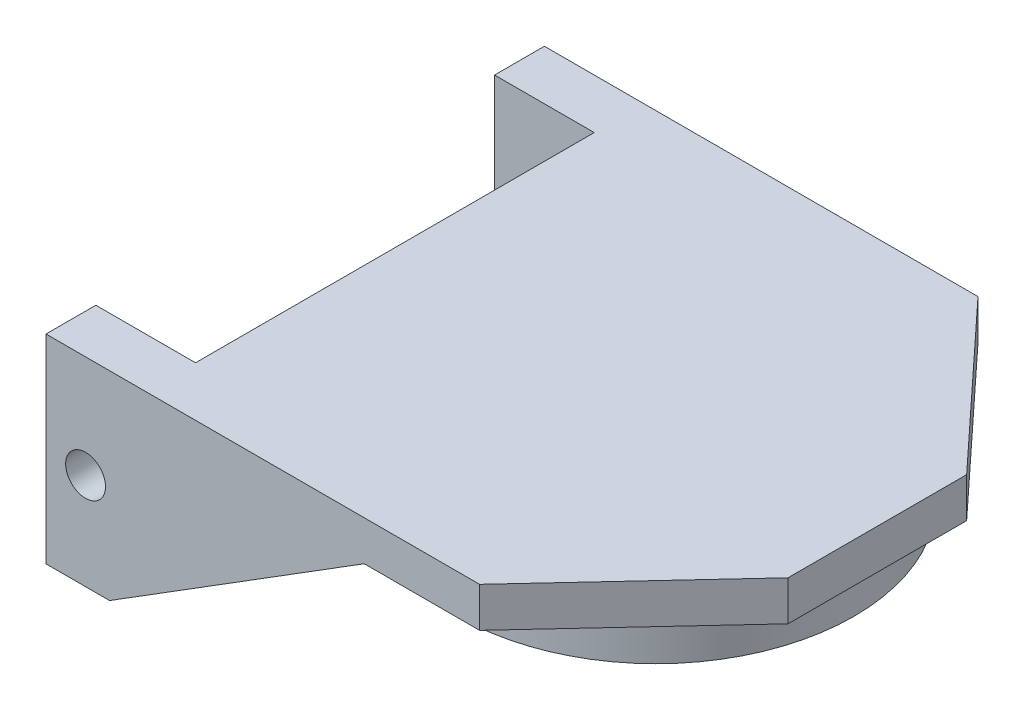
from build123d import *

# Parameters (mm, degrees)
BOSS_EXTRUDE1_DEPTH = 2
BOSS_EXTRUDE2_DEPTH = 2
SKETCH3_R           = 1
BOSS_EXTRUDE3_DEPTH = 2.5
SKETCH5_R           = 1
BOSS_EXTRUDE5_DEPTH = 2.5
SKETCH6_R           = 1
CUT_EXTRUDE1_DEPTH  = 2.5
BOSS_EXTRUDE6_START = -2.5
SKETCH8_R           = 1
BOSS_EXTRUDE6_DEPTH = 2.5
CUT_EXTRUDE2_DEPTH  = 2.5
SKETCH10_R          = 9.941576331
SKETCH10_R_2        = 9.5
BOSS_EXTRUDE9_DEPTH = 2.5


with BuildPart() as part:
    # Sketch1 → Boss-Extrude1 (new body)
    with BuildSketch(Plane(origin=(0, 0, 0), x_dir=(1, 0, 0), z_dir=(0, 1, 0))):
        Polygon((0, 2.5), (0, 0), (26, 0), (26, 25), (0, 25), (0, 22.5), (5, 22.5), (5, 2.5), align=None)
    extrude(amount=BOSS_EXTRUDE1_DEPTH)

    # Sketch2 → Boss-Extrude2 (add)
    with BuildSketch(Plane(origin=(0, 2, 0), x_dir=(1, 0, 0), z_dir=(0, 1, 0))):
        Polygon((26, 25), (40.579221248, 15.4966373), (40.579221248, 9.198619924), (26, 0), align=None)
    extrude(amount=-BOSS_EXTRUDE2_DEPTH)

    # Sketch3 → Boss-Extrude3 (add)
    with BuildSketch(Plane.XY):
        Polygon((15.962952465, 0), (0, 0), (0, -7.986136178), (3.187790207, -7.986136178), align=None)
        with Locations((1.984518411, -4.657937593)):
            Circle(SKETCH3_R, mode=Mode.SUBTRACT)
    extrude(amount=-BOSS_EXTRUDE3_DEPTH)

    # Sketch5 → Boss-Extrude5 (add)
    with BuildSketch(Plane.XY):
        with Locations((1.984518411, -4.657937593)):
            Circle(SKETCH5_R)
    extrude(amount=-BOSS_EXTRUDE5_DEPTH)

    # Sketch6 → Cut-Extrude1 (cut)
    with BuildSketch(Plane.XY):
        with Locations((1.984518411, -3.146677254)):
            Circle(SKETCH6_R)
    extrude(amount=-CUT_EXTRUDE1_DEPTH, mode=Mode.SUBTRACT)

    # Sketch8 → Boss-Extrude6 (add)
    with BuildSketch(Plane(origin=(0, 0, -25), x_dir=(-1, 0, 0), z_dir=(0, 0, -1)).offset(BOSS_EXTRUDE6_START)):
        Polygon((0, 0), (0, -7.986136178), (-3.187790207, -7.986136178), (-15.962952465, 0), align=None)
        with Locations(Location((-1.984518411, -3.146677254, 0), (0, 0, 180))):
            Circle(SKETCH8_R, mode=Mode.SUBTRACT)
    extrude(amount=BOSS_EXTRUDE6_DEPTH)

    # Sketch9 → Cut-Extrude2 (cut)
    with BuildSketch(Plane(origin=(0, 2, 0), x_dir=(1, 0, 0), z_dir=(0, 1, 0))):
        Polygon((21.748897696, 25), (29.198942219, 16.980267325), (29.198942219, 8.019732675), (21.748897696, 0), (26, 0), (40.579221248, 9.198619924), (40.579221248, 15.4966373), (26, 25), align=None)
    extrude(amount=-CUT_EXTRUDE2_DEPTH, mode=Mode.SUBTRACT)

    # Sketch10 → Boss-Extrude9 (add)
    with BuildSketch(Plane.XZ):
        with Locations(Location((18.089845789, -12.5, 0), (0, 0, 90))):
            Circle(SKETCH10_R)
        with Locations(Location((18.089845789, -12.5, 0), (0, 0, 270))):
            Circle(SKETCH10_R_2, mode=Mode.SUBTRACT)
    extrude(amount=BOSS_EXTRUDE9_DEPTH)


solid = part.part
